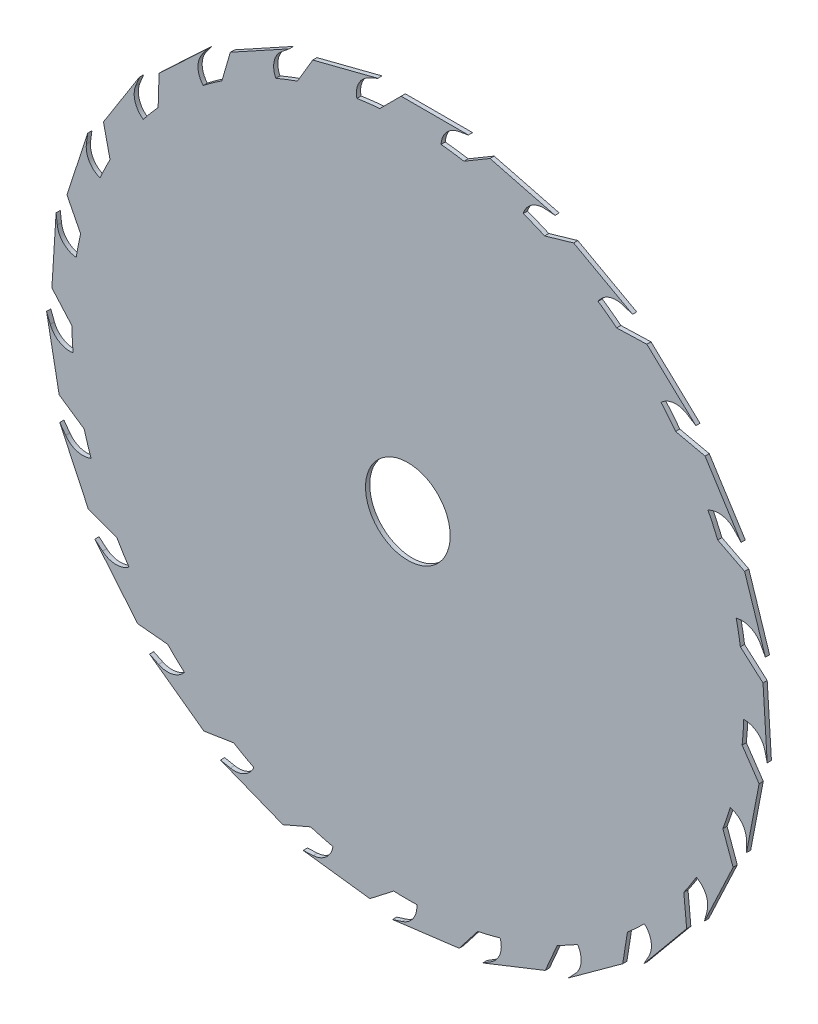
from build123d import *

# Parameters (mm, degrees)
SKETCH1_R           = 127
BOSS_EXTRUDE1_DEPTH = 1.5875
CUT_EXTRUDE1_REACH  = 181.612
SKETCH2_R           = 16.002
BOSS_EXTRUDE2_DEPTH = 1.5875
CIRPATTERN1_COUNT   = 25


with BuildPart() as part:
    # Sketch1 → Boss-Extrude1 (new body)
    with BuildSketch(Plane.XY):
        Circle(SKETCH1_R)
    extrude(amount=BOSS_EXTRUDE1_DEPTH)

    # Sketch2 → Cut-Extrude1 (cut, up to next)
    with BuildSketch(Plane.XY.offset(1.5875), mode=Mode.PRIVATE) as cut_extrude1_sk1:
        Circle(SKETCH2_R)
    cut_extrude1_tool1 = extrude(cut_extrude1_sk1.sketch, amount=-CUT_EXTRUDE1_REACH, mode=Mode.PRIVATE) & part.part
    add(cut_extrude1_tool1.solids().sort_by_distance((0, 0, 1.5875))[0], mode=Mode.SUBTRACT)

    # Sketch4 → Boss-Extrude2 (add)
    with BuildSketch(Plane.XY.offset(1.5875)):
        with BuildLine():
            Line((-12.7, 124.46), (-2.54, 134.62))
            Line((-2.54, 134.62), (22.86, 134.62))
            Line((22.86, 134.62), (19.112917361, 133.930455445))
            ThreePointArc((19.112917361, 133.930455445), (13.922314054, 130.538790933), (12.7, 124.46))
            Line((12.7, 124.46), (-12.7, 124.46))
        make_face()
    boss_extrude2 = extrude(amount=-BOSS_EXTRUDE2_DEPTH)

    # CirPattern1: Boss-Extrude2 ×25 about axis
    cirpattern1_axis = Axis((0, 0, 0), (0, 0, 1))
    for i in range(1, CIRPATTERN1_COUNT):
        add(boss_extrude2.rotate(cirpattern1_axis, i * 360 / CIRPATTERN1_COUNT))


solid = part.part
